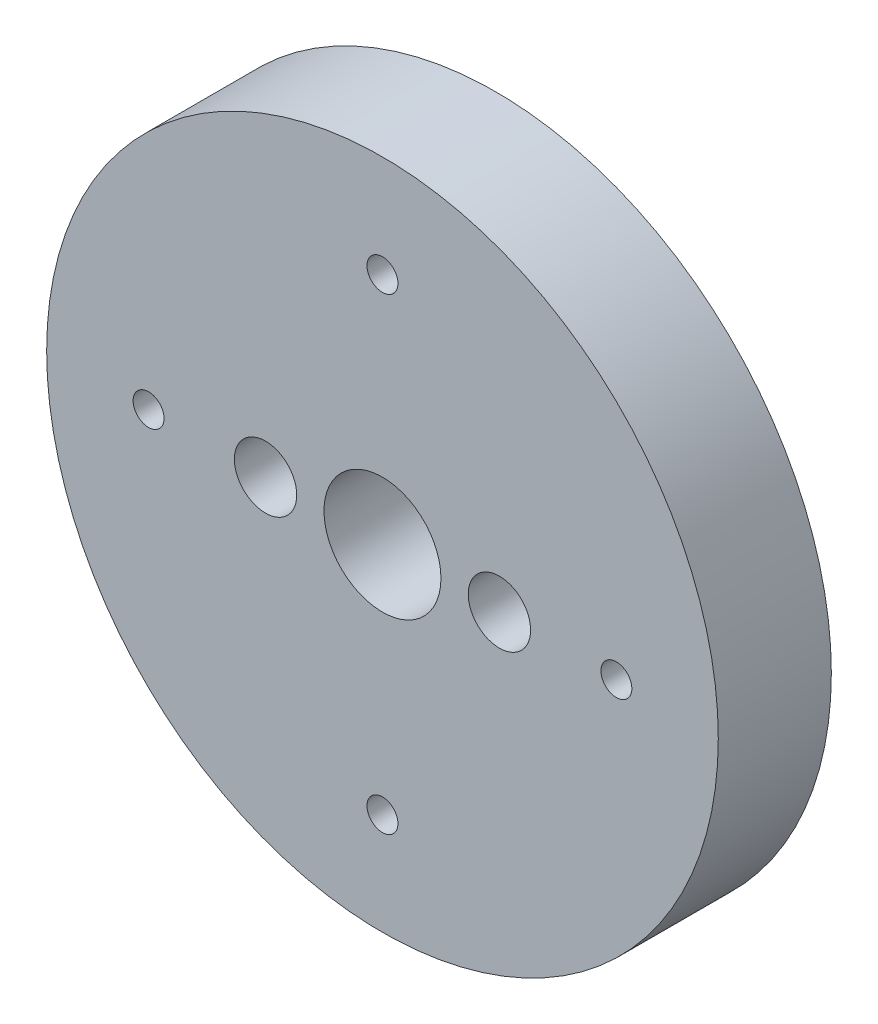
from build123d import *

# Parameters (mm, degrees)
SKETCH1_R                = 17.229166667
SKETCH1_R_2              = 3
BOSS_EXTRUDE1_DEPTH      = 5.8
SKETCH2_R                = 0.79375
CUT_EXTRUDE1_DEPTH       = 26.046524071
M3_CLEARANCE_HOLE1_D     = 3.2
M3_CLEARANCE_HOLE1_DEPTH = 12.7
M3_CLEARANCE_HOLE1_TIP   = 0.96137699


with BuildPart() as part:
    # Sketch1 → Boss-Extrude1 (new body)
    with BuildSketch(Plane.XY):
        Circle(SKETCH1_R)
        Circle(SKETCH1_R_2, mode=Mode.SUBTRACT)
    extrude(amount=BOSS_EXTRUDE1_DEPTH)

    # Sketch2 → Cut-Extrude1 (cut, through all)
    with BuildSketch(Plane.XY.offset(5.8)):
        with Locations((0, 12)):
            Circle(SKETCH2_R)
        with Locations((12, 0)):
            Circle(SKETCH2_R)
        with Locations((0, -12)):
            Circle(SKETCH2_R)
        with Locations((-12, 0)):
            Circle(SKETCH2_R)
    extrude(amount=-CUT_EXTRUDE1_DEPTH, mode=Mode.SUBTRACT)

    # M3 Clearance Hole1
    with Locations(Plane.XY.offset(5.8)):
        with Locations((-6, 0), (6, 0)):
            Hole(M3_CLEARANCE_HOLE1_D / 2, depth=M3_CLEARANCE_HOLE1_DEPTH)
            with Locations((0, 0, -(M3_CLEARANCE_HOLE1_DEPTH + M3_CLEARANCE_HOLE1_TIP / 2))):  # 118° drill point
                Cone(0, M3_CLEARANCE_HOLE1_D / 2, M3_CLEARANCE_HOLE1_TIP, mode=Mode.SUBTRACT)


solid = part.part
